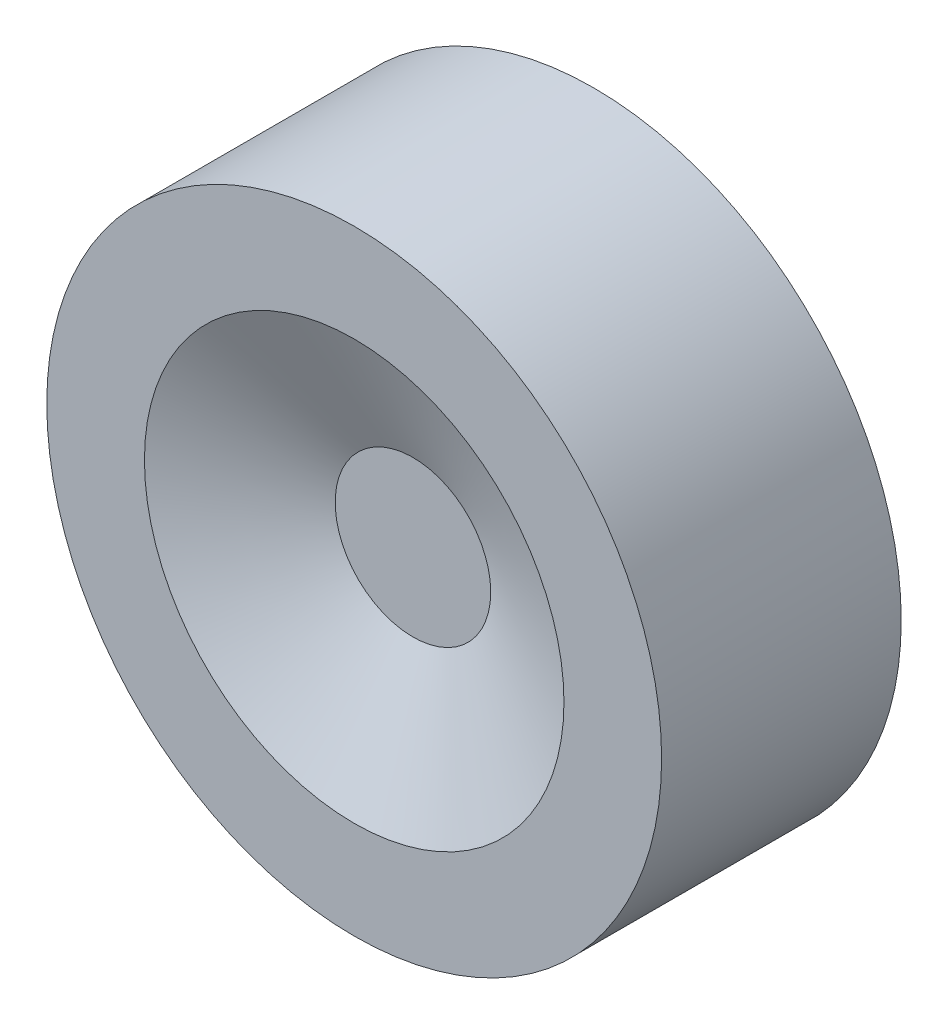
from build123d import *

# Parameters (mm, degrees)
SKETCH1_R           = 34
BOSS_EXTRUDE1_DEPTH = 26.5
SKETCH2_R           = 23.2
CUT_EXTRUDE1_DEPTH  = 6.5
CUT_EXTRUDE1_DRAFT  = -66
SKETCH3_R           = 5.75
BOSS_EXTRUDE2_DEPTH = 5


with BuildPart() as part:
    # Sketch1 → Boss-Extrude1 (new body)
    with BuildSketch(Plane.XY):
        Circle(SKETCH1_R)
    extrude(amount=BOSS_EXTRUDE1_DEPTH)


with BuildPart() as cut_extrude1_tool:
    # Sketch2 → Cut-Extrude1 (with draft: the straight prism first)
    with BuildSketch(Plane.XY.offset(26.5)):
        Circle(SKETCH2_R)
    extrude(amount=-CUT_EXTRUDE1_DEPTH)
    # Cut-Extrude1: the draft: its side faces are tilted about the plane it starts from
    cut_extrude1_sides = [cut_extrude1_tool.faces().sort_by_distance(p)[0] for p in [
        (-23.2, 0, 23.25),
    ]]
    draft(cut_extrude1_sides, Plane.XY.offset(26.5), CUT_EXTRUDE1_DRAFT)


with BuildPart() as part_1:
    add(part.part)

    # Cut-Extrude1: cut by cut_extrude1_tool
    add(cut_extrude1_tool.part, mode=Mode.SUBTRACT)

    # Sketch3 → Boss-Extrude2 (add)
    with BuildSketch(Plane(origin=(0, 0, 0), x_dir=(-1, 0, 0), z_dir=(0, 0, -1))):
        Circle(SKETCH3_R)
    extrude(amount=BOSS_EXTRUDE2_DEPTH)


solid = part_1.part
